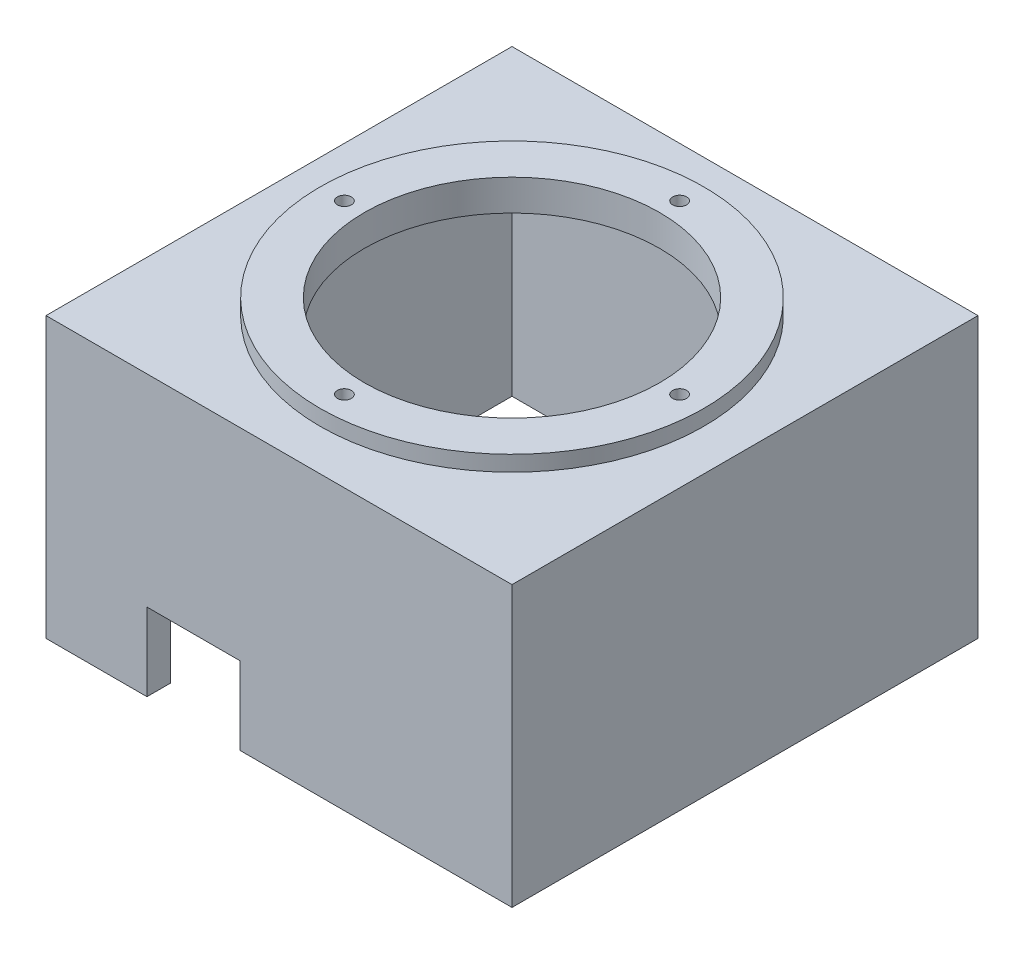
from build123d import *
from build123d.topology import SkipClean

# Parameters (mm, degrees)
SKETCH1_R           = 61.765082955
SKETCH1_R_2         = 47.5
BOSS_EXTRUDE1_DEPTH = 5
SKETCH7_R           = 2.25
CUT_EXTRUDE1_DEPTH  = 9.5
SKETCH9_W           = 150
SKETCH9_H           = 150
SKETCH9_R           = 2.25
SKETCH9_R_2         = 47.5
BOSS_EXTRUDE2_DEPTH = 90
CUT_EXTRUDE2_DEPTH  = 60
SKETCH10_W          = 135
SKETCH10_H          = 135
CUT_EXTRUDE4_DEPTH  = 85


with BuildPart() as part:
    # Sketch1 → Boss-Extrude1 (new body)
    with BuildSketch(Plane(origin=(0, 0, 0), x_dir=(1, 0, 0), z_dir=(0, 1, 0))):
        with Locations(Location((0, 0, 0), (0, 0, 270))):
            Circle(SKETCH1_R)
        with Locations(Location((0, 0, 0), (0, 0, 270))):
            Circle(SKETCH1_R_2, mode=Mode.SUBTRACT)
    extrude(amount=BOSS_EXTRUDE1_DEPTH)

    # Sketch7 → Cut-Extrude1 (cut)
    with BuildSketch(Plane(origin=(0, 5, 0), x_dir=(1, 0, 0), z_dir=(0, 1, 0))):
        with Locations(Location((0, 53.95, 0), (0, 0, 270))):
            Circle(SKETCH7_R)
        with Locations(Location((0, -53.95, 0), (0, 0, 270))):
            Circle(SKETCH7_R)
        with Locations(Location((53.95, 0, 0), (0, 0, 270))):
            Circle(SKETCH7_R)
        with Locations(Location((-53.95, 0, 0), (0, 0, 270))):
            Circle(SKETCH7_R)
    extrude(amount=-CUT_EXTRUDE1_DEPTH, mode=Mode.SUBTRACT)

    # Sketch9 → Boss-Extrude2 (add)
    with SkipClean():  # the faces are left unmerged after this step: merging them gives an invalid solid
        with BuildSketch(Plane(origin=(0, 0, 0), x_dir=(-1, 0, 0), z_dir=(0, -1, 0))):
            Rectangle(SKETCH9_W, SKETCH9_H)
            with Locations(Location((0, -53.95, 0), (0, 0, 90))):
                Circle(SKETCH9_R, mode=Mode.SUBTRACT)
            with Locations(Location((53.95, 0, 0), (0, 0, 90))):
                Circle(SKETCH9_R, mode=Mode.SUBTRACT)
            with Locations(Location((0, 53.95, 0), (0, 0, 270))):
                Circle(SKETCH9_R, mode=Mode.SUBTRACT)
            with Locations(Location((-53.95, 0, 0), (0, 0, 270))):
                Circle(SKETCH9_R, mode=Mode.SUBTRACT)
            with Locations(Location((0, 0, 0), (0, 0, 90))):
                Circle(SKETCH9_R_2, mode=Mode.SUBTRACT)
        extrude(amount=BOSS_EXTRUDE2_DEPTH)

    # 3DSketch2 → Cut-Extrude2 (cut)
    with SkipClean():  # the faces are left unmerged after this step: merging them gives an invalid solid
        with BuildSketch(Plane(origin=(-42.5, -65, 75), x_dir=(0.7071067811865476, -0.7071067811865476, 0), z_dir=(0, 0, 1))):
            Polygon((0, 0), (21.213203436, 21.213203436), (42.426406871, 0), (21.213203436, -21.213203436), align=None)
        extrude(amount=-CUT_EXTRUDE2_DEPTH, mode=Mode.SUBTRACT)

    # Sketch10 → Cut-Extrude4 (cut)
    with SkipClean():  # the faces are left unmerged after this step: merging them gives an invalid solid
        with BuildSketch(Plane.XZ.offset(90)):
            Rectangle(SKETCH10_W, SKETCH10_H)
        extrude(amount=-CUT_EXTRUDE4_DEPTH, mode=Mode.SUBTRACT)


solid = part.part
